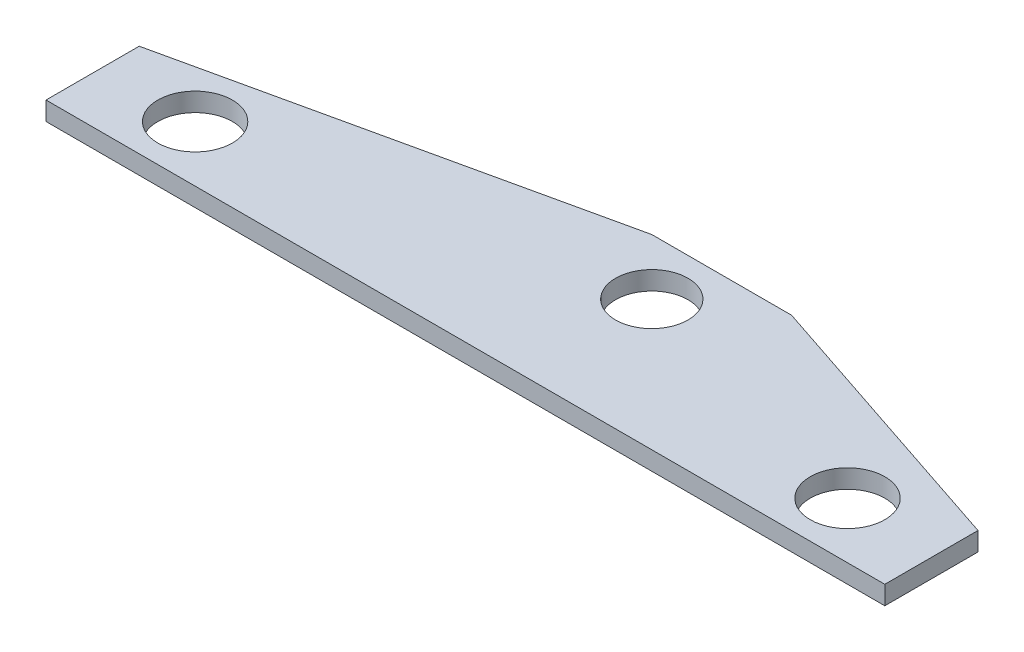
from build123d import *

# Parameters (mm, degrees)
SKETCH1_W           = 90
SKETCH1_H           = 20
BOSS_EXTRUDE1_DEPTH = 2
SKETCH2_R           = 4
SKETCH2_R_2         = 3.883174387
CUT_EXTRUDE1_DEPTH  = 2


with BuildPart() as part:
    # Sketch1 → Boss-Extrude1 (new body)
    with BuildSketch(Plane(origin=(0, 0, 0), x_dir=(1, 0, 0), z_dir=(0, 1, 0))):
        with Locations((45, 10)):
            Rectangle(SKETCH1_W, SKETCH1_H)
    extrude(amount=BOSS_EXTRUDE1_DEPTH)

    # Sketch2 → Cut-Extrude1 (cut)
    with BuildSketch(Plane(origin=(0, 2, 0), x_dir=(1, 0, 0), z_dir=(0, 1, 0))):
        with Locations(Location((10, 6, 0), (0, 0, 270))):
            Circle(SKETCH2_R)
        with Locations(Location((51, 14, 0), (0, 0, 270))):
            Circle(SKETCH2_R_2)
        with Locations(Location((80, 6, 0), (0, 0, 270))):
            Circle(SKETCH2_R)
        Polygon((0, 20), (0, 10), (45, 20), align=None)
        Polygon((90, 20), (60, 20), (90, 10), align=None)
    extrude(amount=-CUT_EXTRUDE1_DEPTH, mode=Mode.SUBTRACT)


solid = part.part
